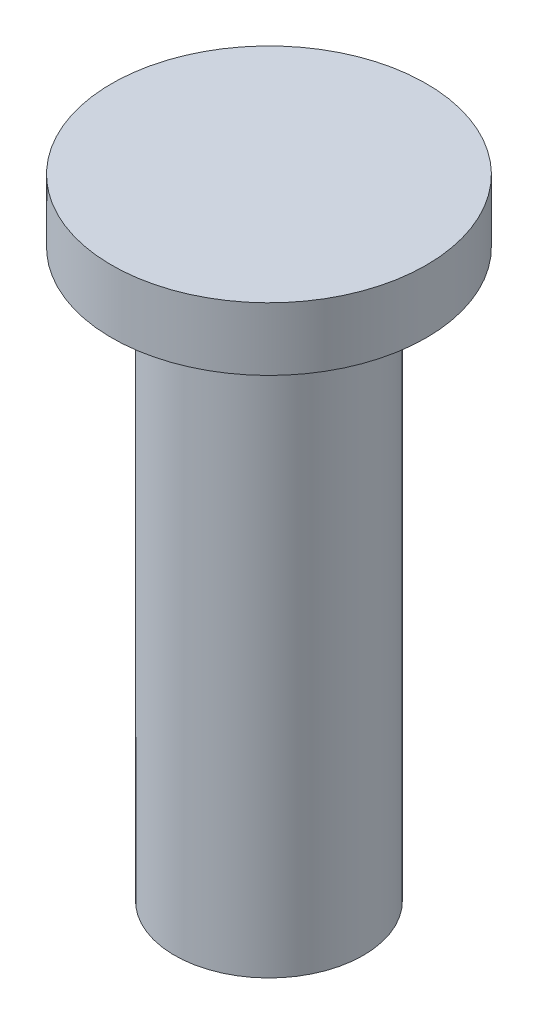
from build123d import *


with BuildPart() as part:
    # Sketch1 → Revolve1 (revolve)
    with BuildSketch(Plane.XY, mode=Mode.PRIVATE) as revolve1_sk:
        Polygon((0, -1.269230769), (0, 8.730769231), (-2.5, 8.730769231), (-2.5, 7.730769231), (-1.5, 7.730769231), (-1.5, -1.269230769), align=None)
    revolve(revolve1_sk.sketch.rotate(Axis((0, -1.269230769, 0), (0, 1, 0)), 180), axis=Axis((0, -1.269230769, 0), (0, 1, 0)))


solid = part.part
